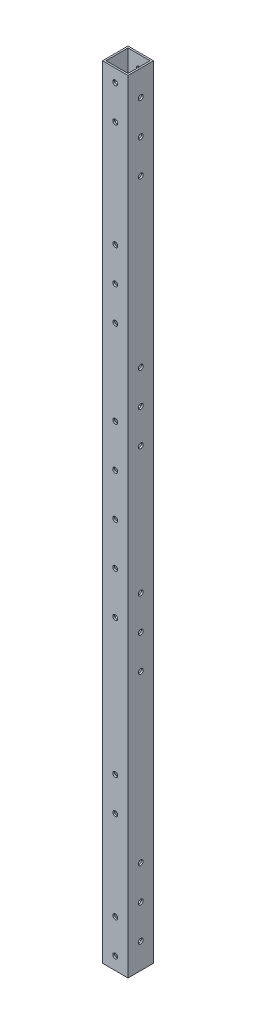
from build123d import *

# Parameters (mm, degrees)
SKETCH_1_W          = 15
SKETCH_1_H          = 15
SKETCH_1_W_2        = 13
SKETCH_1_H_2        = 13
EXTRUDE_1_DEPTH     = 460
SKETCH_2_R          = 1.45
CUT_EXTRUDE_1_DEPTH = 461.305605006
SKETCH_3_R          = 1.45
CUT_EXTRUDE_2_DEPTH = 461.305605006


with BuildPart() as part:
    # 草图1 → 拉伸-薄壁1 (new body)
    with BuildSketch(Plane(origin=(0, 0, 0), x_dir=(1, 0, 0), z_dir=(0, 1, 0))):
        Rectangle(SKETCH_1_W, SKETCH_1_H)
        Rectangle(SKETCH_1_W_2, SKETCH_1_H_2, mode=Mode.SUBTRACT)
    extrude(amount=EXTRUDE_1_DEPTH)

    # 草图2 → 切除-拉伸1 (cut, through all)
    with BuildSketch(Plane.XY.offset(7.5)):
        with Locations((0, 7.5)):
            Circle(SKETCH_2_R)
        with Locations((0, 27.5)):
            Circle(SKETCH_2_R)
        with Locations(Location((0, 432.5, 0), (0, 0, 180))):
            Circle(SKETCH_2_R)
        with Locations(Location((0, 452.5, 0), (0, 0, 180))):
            Circle(SKETCH_2_R)
        with Locations((0, 80)):
            Circle(SKETCH_2_R)
        with Locations((0, 100)):
            Circle(SKETCH_2_R)
        with Locations((0, 350)):
            Circle(SKETCH_2_R)
        with Locations((0, 370)):
            Circle(SKETCH_2_R)
        with Locations((0, 330)):
            Circle(SKETCH_2_R)
        with Locations((0, 230)):
            Circle(SKETCH_2_R)
        with Locations((0, 255)):
            Circle(SKETCH_2_R)
        with Locations((0, 280)):
            Circle(SKETCH_2_R)
        with Locations((0, 205)):
            Circle(SKETCH_2_R)
        with Locations((0, 180)):
            Circle(SKETCH_2_R)
    extrude(amount=-CUT_EXTRUDE_1_DEPTH, mode=Mode.SUBTRACT)

    # 草图3 → 切除-拉伸2 (cut, through all)
    with BuildSketch(Plane(origin=(7.5, 0, 0), x_dir=(0, 0, -1), z_dir=(1, 0, 0))):
        with Locations((0, 15)):
            Circle(SKETCH_3_R)
        with Locations((0, 35)):
            Circle(SKETCH_3_R)
        with Locations((0, 425)):
            Circle(SKETCH_3_R)
        with Locations((0, 445)):
            Circle(SKETCH_3_R)
        with Locations((0, 172.5)):
            Circle(SKETCH_3_R)
        with Locations((0, 192.5)):
            Circle(SKETCH_3_R)
        with Locations((0, 152.5)):
            Circle(SKETCH_3_R)
        with Locations((0, 307.5)):
            Circle(SKETCH_3_R)
        with Locations((0, 267.5)):
            Circle(SKETCH_3_R)
        with Locations((0, 287.5)):
            Circle(SKETCH_3_R)
        with Locations((0, 55)):
            Circle(SKETCH_3_R)
        with Locations((0, 405)):
            Circle(SKETCH_3_R)
    extrude(amount=-CUT_EXTRUDE_2_DEPTH, mode=Mode.SUBTRACT)


solid = part.part
